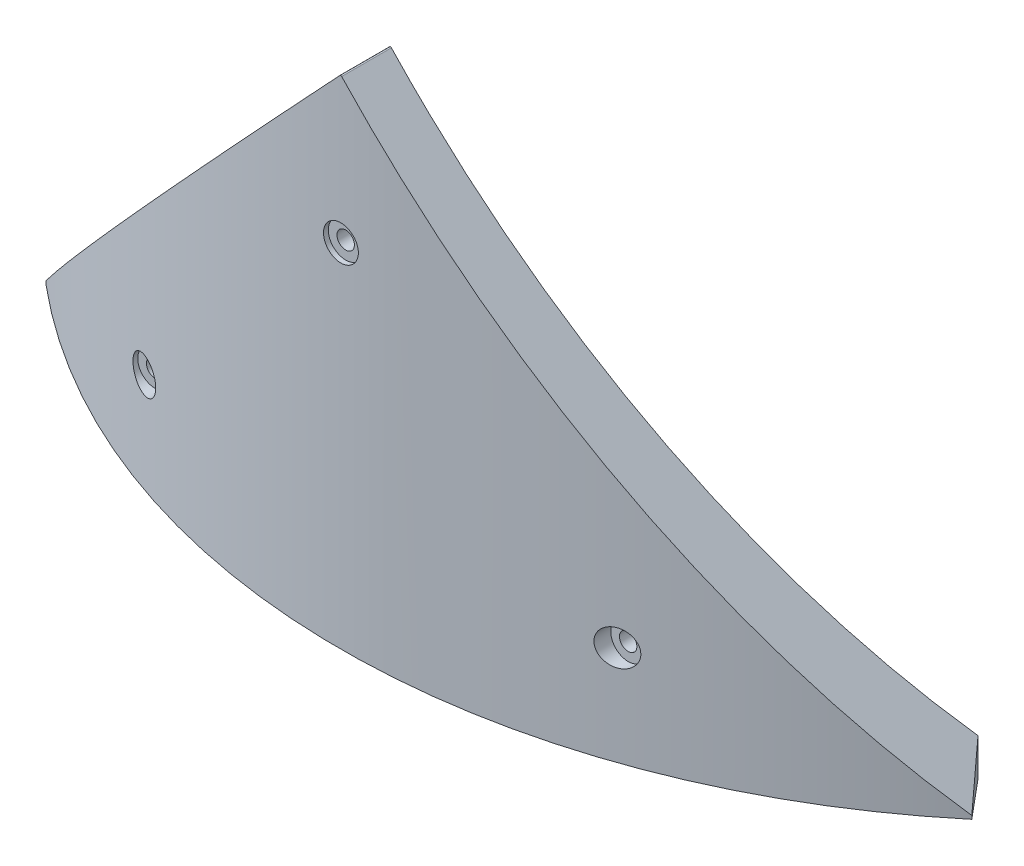
from build123d import *

# Parameters (mm, degrees)
BOSS_EXTRUDE1_DEPTH = 100
CUT_EXTRUDE1_DEPTH  = 100
CUT_EXTRUDE3_DEPTH  = 100
FILLET1_R           = 0.25
CUT_EXTRUDE4_DEPTH  = 100
SKETCH6_R           = 3.5
CUT_EXTRUDE5_DEPTH  = 1
SKETCH7_R           = 3.5
CUT_EXTRUDE6_DEPTH  = 10.24


with BuildPart() as part:
    # Sketch1 → Boss-Extrude1 (new body)
    with BuildSketch(Plane.XY):
        Polygon((-93.7, 0), (93.7, 0), (0, 100), align=None)
    extrude(amount=BOSS_EXTRUDE1_DEPTH)

    # Sketch3 → Cut-Extrude1 (cut)
    with BuildSketch(Plane(origin=(0, 0, 0), x_dir=(1, 0, 0), z_dir=(0, 1, 0))):
        with BuildLine():
            Line((86.649916098, -18.521939898), (93.7, -26.944779698))
            Line((93.7, -26.944779698), (117.286189742, 18.149796591))
            ThreePointArc((117.286189742, 18.149796591), (0, 220), (-117.286189742, 18.149796591))
            Line((-117.286189742, 18.149796591), (-93.7, -26.944779698))
            Line((-93.7, -26.944779698), (-86.649916098, -18.521939898))
            ThreePointArc((-86.649916098, -18.521939898), (0, -50), (86.649916098, -18.521939898))
        make_face()
    extrude(amount=CUT_EXTRUDE1_DEPTH, mode=Mode.SUBTRACT)

    # Sketch4 → Cut-Extrude3 (cut)
    with BuildSketch(Plane(origin=(0, 0, 0), x_dir=(1, 0, 0), z_dir=(0, 1, 0))):
        with BuildLine():
            Line((-145, 85), (-145, -157.27076369))
            Line((-145, -157.27076369), (195.83768652, -157.27076369))
            Line((195.83768652, -157.27076369), (144.517709557, 73.183417402))
            ThreePointArc((144.517709557, 73.183417402), (-5.913210388, -59.879377217), (-145, 85))
        make_face()
    extrude(amount=CUT_EXTRUDE3_DEPTH, mode=Mode.SUBTRACT)

    # Fillet1
    fillet1_edges = [part.edges().sort_by_distance(p)[0] for p in [
        (0, 100, 55),
    ]]
    fillet(fillet1_edges, radius=FILLET1_R)

    # Sketch5 → Cut-Extrude4 (cut)
    with BuildSketch(Plane.XY):
        with BuildLine():
            ThreePointArc((1.75, 70.74941109), (-0.695889742, 72.355100184), (-1.196557105, 69.472402439))
            Line((-1.196557105, 69.472402439), (0, 70.74941109))
            Line((0, 70.74941109), (1.196557105, 69.472402439))
            ThreePointArc((1.196557105, 69.472402439), (1.605689094, 70.053521348), (1.75, 70.74941109))
        make_face()
        with BuildLine():
            Line((0, 70.74941109), (-1.196557105, 69.472402439))
            ThreePointArc((-1.196557105, 69.472402439), (0, 68.99941109), (1.196557105, 69.472402439))
            Line((1.196557105, 69.472402439), (0, 70.74941109))
        make_face()
        with BuildLine():
            ThreePointArc((46.355641086, 21.27700865), (45.946509097, 20.695889742), (45.802198191, 20))
            Line((45.802198191, 20), (47.552198191, 20))
            Line((47.552198191, 20), (46.355641086, 21.27700865))
        make_face()
        with BuildLine():
            Line((47.552198191, 20), (45.802198191, 20))
            ThreePointArc((45.802198191, 20), (47.552198191, 18.25), (49.302198191, 20))
            ThreePointArc((49.302198191, 20), (48.248087933, 21.605689094), (46.355641086, 21.27700865))
            Line((46.355641086, 21.27700865), (47.552198191, 20))
        make_face()
        with BuildLine():
            Line((-46.355641086, 21.27700865), (-47.552198191, 20))
            Line((-47.552198191, 20), (-45.802198191, 20))
            ThreePointArc((-45.802198191, 20), (-45.946509097, 20.695889742), (-46.355641086, 21.27700865))
        make_face()
        with BuildLine():
            Line((-45.802198191, 20), (-47.552198191, 20))
            Line((-47.552198191, 20), (-46.355641086, 21.27700865))
            ThreePointArc((-46.355641086, 21.27700865), (-49.157887285, 19.304110258), (-45.802198191, 20))
        make_face()
    extrude(amount=CUT_EXTRUDE4_DEPTH, mode=Mode.SUBTRACT)

    # Sketch6 → Cut-Extrude5 (cut)
    with BuildSketch(Plane.XY.offset(60)):
        with Locations((0, 70.74941109)):
            Circle(SKETCH6_R)
    extrude(amount=-CUT_EXTRUDE5_DEPTH, mode=Mode.SUBTRACT)

    # Sketch7 → Cut-Extrude6 (cut)
    with BuildSketch(Plane.XY.offset(60)):
        with Locations((-47.552198191, 20)):
            Circle(SKETCH7_R)
        with Locations((47.552198191, 20)):
            Circle(SKETCH7_R)
    extrude(amount=-CUT_EXTRUDE6_DEPTH, mode=Mode.SUBTRACT)


solid = part.part
